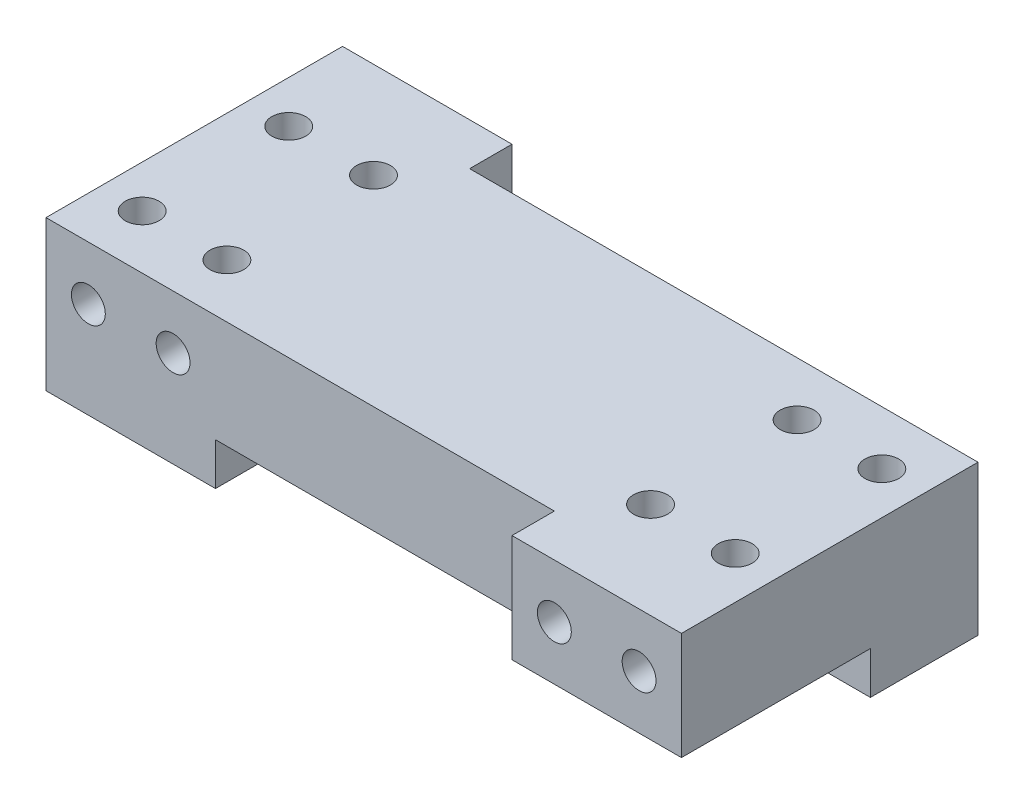
from build123d import *
from build123d.topology import SkipClean

# Parameters (mm, degrees)
SKETCH1_W           = 80
SKETCH1_H           = 80
BOSS_EXTRUDE1_DEPTH = 12.7
SKETCH2_R           = 2
CUT_EXTRUDE1_DEPTH  = 114.847661373
SKETCH3_W           = 60
SKETCH3_H           = 12.7
CUT_EXTRUDE2_DEPTH  = 25
SKETCH4_W           = 60
SKETCH4_H           = 12.7
CUT_EXTRUDE3_DEPTH  = 25
SKETCH5_R           = 2
CUT_EXTRUDE4_DEPTH  = 114.847661373
SKETCH6_W           = 20
SKETCH6_H           = 12.7
CUT_EXTRUDE5_DEPTH  = 20
SKETCH8_W           = 20
SKETCH8_H           = 12.7
CUT_EXTRUDE6_DEPTH  = 20
SKETCH9_W           = 20
SKETCH9_H           = 12.7
SKETCH9_R           = 2
BOSS_EXTRUDE3_DEPTH = 5


with BuildPart() as part:
    # Sketch1 → Boss-Extrude1 (new body)
    with BuildSketch(Plane(origin=(0, 0, 0), x_dir=(1, 0, 0), z_dir=(0, 1, 0))):
        with Locations((-40, 40)):
            Rectangle(SKETCH1_W, SKETCH1_H)
    extrude(amount=BOSS_EXTRUDE1_DEPTH)

    # Sketch2 → Cut-Extrude1 (cut, through all)
    with BuildSketch(Plane.XY):
        with Locations((-75, 6.35)):
            Circle(SKETCH2_R)
        with Locations((-65, 6.35)):
            Circle(SKETCH2_R)
        with Locations((-15, 6.35)):
            Circle(SKETCH2_R)
        with Locations((-5, 6.35)):
            Circle(SKETCH2_R)
    extrude(amount=-CUT_EXTRUDE1_DEPTH, mode=Mode.SUBTRACT)

    # Sketch3 → Cut-Extrude2 (cut)
    with BuildSketch(Plane.XY):
        with Locations((-50, 6.35)):
            Rectangle(SKETCH3_W, SKETCH3_H)
    extrude(amount=-CUT_EXTRUDE2_DEPTH, mode=Mode.SUBTRACT)

    # Sketch4 → Cut-Extrude3 (cut)
    with BuildSketch(Plane(origin=(0, 0, -80), x_dir=(-1, 0, 0), z_dir=(0, 0, -1))):
        with Locations((30, 6.35)):
            Rectangle(SKETCH4_W, SKETCH4_H)
    extrude(amount=-CUT_EXTRUDE3_DEPTH, mode=Mode.SUBTRACT)

    # Sketch5 → Cut-Extrude4 (cut, through all)
    with BuildSketch(Plane(origin=(0, 12.7, 0), x_dir=(1, 0, 0), z_dir=(0, 1, 0))):
        with Locations(Location((-75, 48.65, 0), (0, 0, 270))):
            Circle(SKETCH5_R)
        with Locations(Location((-65, 48.65, 0), (0, 0, 270))):
            Circle(SKETCH5_R)
        with Locations(Location((-75, 31.35, 0), (0, 0, 270))):
            Circle(SKETCH5_R)
        with Locations(Location((-65, 31.35, 0), (0, 0, 270))):
            Circle(SKETCH5_R)
        with Locations(Location((-15, 48.65, 0), (0, 0, 270))):
            Circle(SKETCH5_R)
        with Locations(Location((-5, 48.65, 0), (0, 0, 270))):
            Circle(SKETCH5_R)
        with Locations(Location((-5, 31.35, 0), (0, 0, 270))):
            Circle(SKETCH5_R)
        with Locations(Location((-15, 31.35, 0), (0, 0, 270))):
            Circle(SKETCH5_R)
    extrude(amount=-CUT_EXTRUDE4_DEPTH, mode=Mode.SUBTRACT)

    # Sketch6 → Cut-Extrude5 (cut)
    with BuildSketch(Plane.XY):
        with Locations((-10, 6.35)):
            Rectangle(SKETCH6_W, SKETCH6_H)
    extrude(amount=-CUT_EXTRUDE5_DEPTH, mode=Mode.SUBTRACT)

    # Sketch8 → Cut-Extrude6 (cut)
    with BuildSketch(Plane(origin=(0, 0, -80), x_dir=(-1, 0, 0), z_dir=(0, 0, -1))):
        with Locations((70, 6.35)):
            Rectangle(SKETCH8_W, SKETCH8_H)
    extrude(amount=-CUT_EXTRUDE6_DEPTH, mode=Mode.SUBTRACT)

    # Sketch9 → Boss-Extrude3 (add)
    # profile 1 of 2: a face of its own
    with SkipClean():  # the faces are left unmerged after this step: merging them gives an invalid solid
        with BuildSketch(Plane.XZ):
            with Locations((-10, -48.65)):
                Rectangle(SKETCH9_W, SKETCH9_H)
            with Locations((-15, -48.65)):
                Circle(SKETCH9_R, mode=Mode.SUBTRACT)
            with Locations((-5, -48.65)):
                Circle(SKETCH9_R, mode=Mode.SUBTRACT)
        # profile 2 of 2: a face of its own
        with BuildSketch(Plane.XZ):
            with Locations((-70, -31.35)):
                Rectangle(SKETCH9_W, SKETCH9_H)
            with Locations((-65, -31.35)):
                Circle(SKETCH9_R, mode=Mode.SUBTRACT)
            with Locations((-75, -31.35)):
                Circle(SKETCH9_R, mode=Mode.SUBTRACT)
        extrude(amount=BOSS_EXTRUDE3_DEPTH)


solid = part.part
